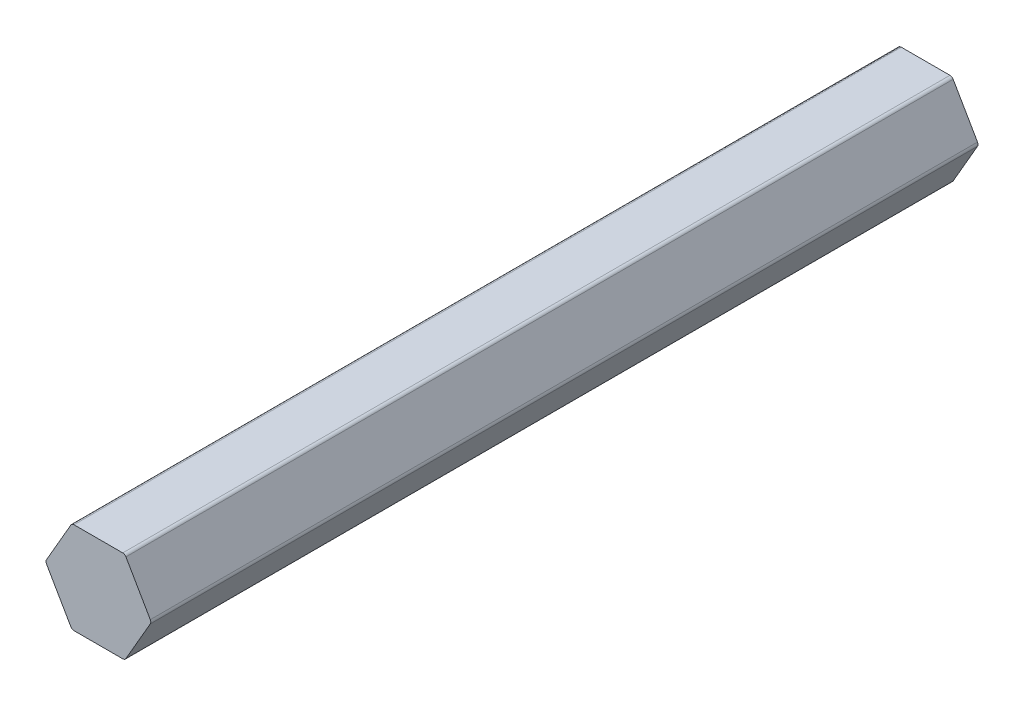
from build123d import *

# Parameters (mm, degrees)
BOSS_EXTRUDE1_DEPTH = 114.3


with BuildPart() as part:
    # Sketch1 → Boss-Extrude1 (new body)
    with BuildSketch(Plane(origin=(0, 0, -228.6), x_dir=(-1, 0, 0), z_dir=(0, 0, -1))):
        with BuildLine():
            Line((3.805488829, -6.0833), (7.171036753, -0.254))
            ThreePointArc((7.171036753, -0.254), (7.239095848, 0), (7.171036753, 0.254))
            Line((7.171036753, 0.254), (3.805488829, 6.0833))
            ThreePointArc((3.805488829, 6.0833), (3.619547924, 6.269240905), (3.365547924, 6.3373))
            Line((3.365547924, 6.3373), (-3.365547924, 6.3373))
            ThreePointArc((-3.365547924, 6.3373), (-3.619547924, 6.269240905), (-3.805488829, 6.0833))
            Line((-3.805488829, 6.0833), (-7.171036753, 0.254))
            ThreePointArc((-7.171036753, 0.254), (-7.239095848, 0), (-7.171036753, -0.254))
            Line((-7.171036753, -0.254), (-3.805488829, -6.0833))
            ThreePointArc((-3.805488829, -6.0833), (-3.619547924, -6.269240905), (-3.365547924, -6.3373))
            Line((-3.365547924, -6.3373), (3.365547924, -6.3373))
            ThreePointArc((3.365547924, -6.3373), (3.619547924, -6.269240905), (3.805488829, -6.0833))
        make_face()
    extrude(amount=-BOSS_EXTRUDE1_DEPTH)


solid = part.part
